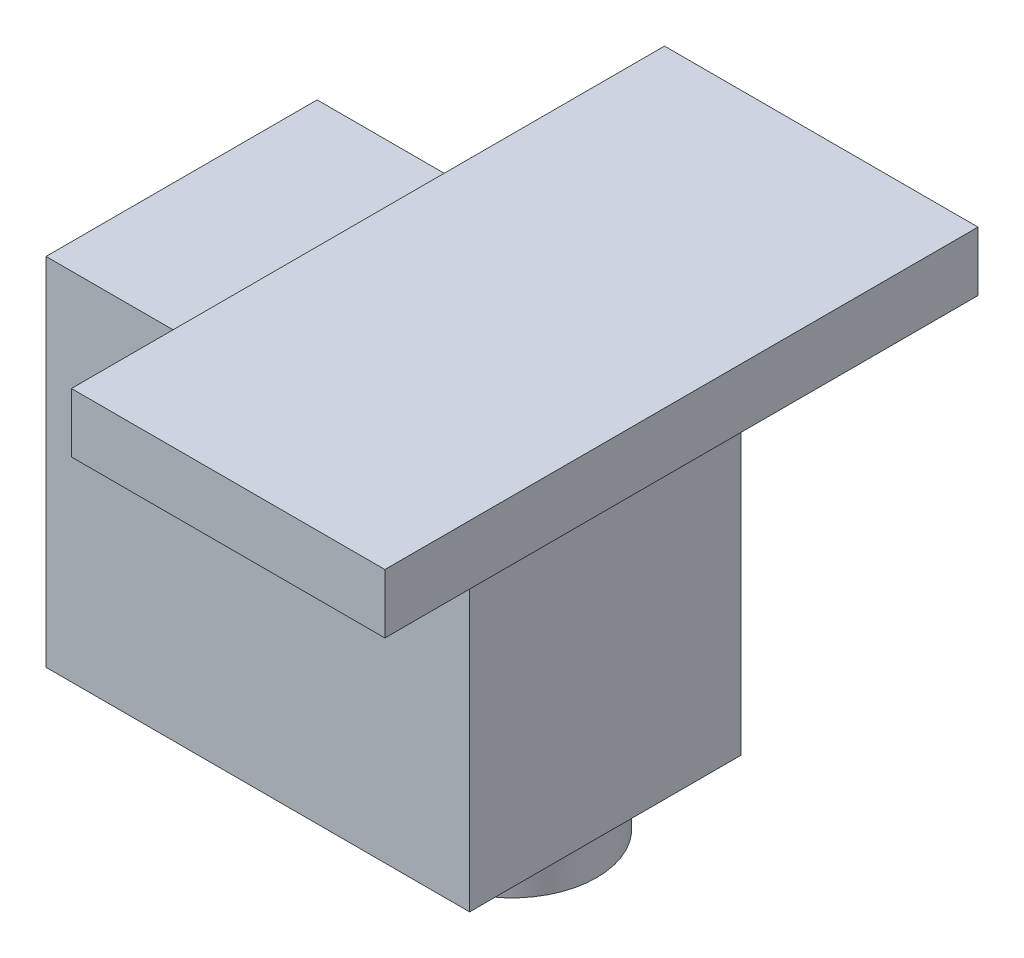
from build123d import *

# Parameters (mm, degrees)
BOSS_EXTRUDE1_DEPTH = 16
BOSS_EXTRUDE2_DEPTH = 16
BOSS_EXTRUDE3_DEPTH = 35
BOSS_EXTRUDE4_DEPTH = 35
SKETCH3_R           = 10
BOSS_EXTRUDE5_DEPTH = 5


with BuildPart() as part:
    # Sketch1 → Boss-Extrude1 (new body)
    with BuildSketch(Plane.XY):
        Polygon((-3, 21), (-25, 21), (-25, -21), (25, -21), (25, 21), align=None)
    extrude(amount=BOSS_EXTRUDE1_DEPTH)

    # Sketch1<3> → Boss-Extrude2 (add)
    with BuildSketch(Plane.XY):
        Polygon((-3, 21), (-25, 21), (-25, -21), (25, -21), (25, 21), align=None)
    extrude(amount=-BOSS_EXTRUDE2_DEPTH)

    # Sketch1<4> → Boss-Extrude3 (add)
    with BuildSketch(Plane.XY):
        Polygon((-3, 28), (-3, 21), (25, 21), (34, 21), (34, 28), align=None)
    extrude(amount=BOSS_EXTRUDE3_DEPTH)

    # Sketch1<5> → Boss-Extrude4 (add)
    with BuildSketch(Plane.XY):
        Polygon((-3, 28), (-3, 21), (25, 21), (34, 21), (34, 28), align=None)
    extrude(amount=-BOSS_EXTRUDE4_DEPTH)

    # Sketch3 → Boss-Extrude5 (add)
    with BuildSketch(Plane.XZ.offset(21)):
        with Locations((14, 0)):
            Circle(SKETCH3_R)
    extrude(amount=BOSS_EXTRUDE5_DEPTH)


solid = part.part
